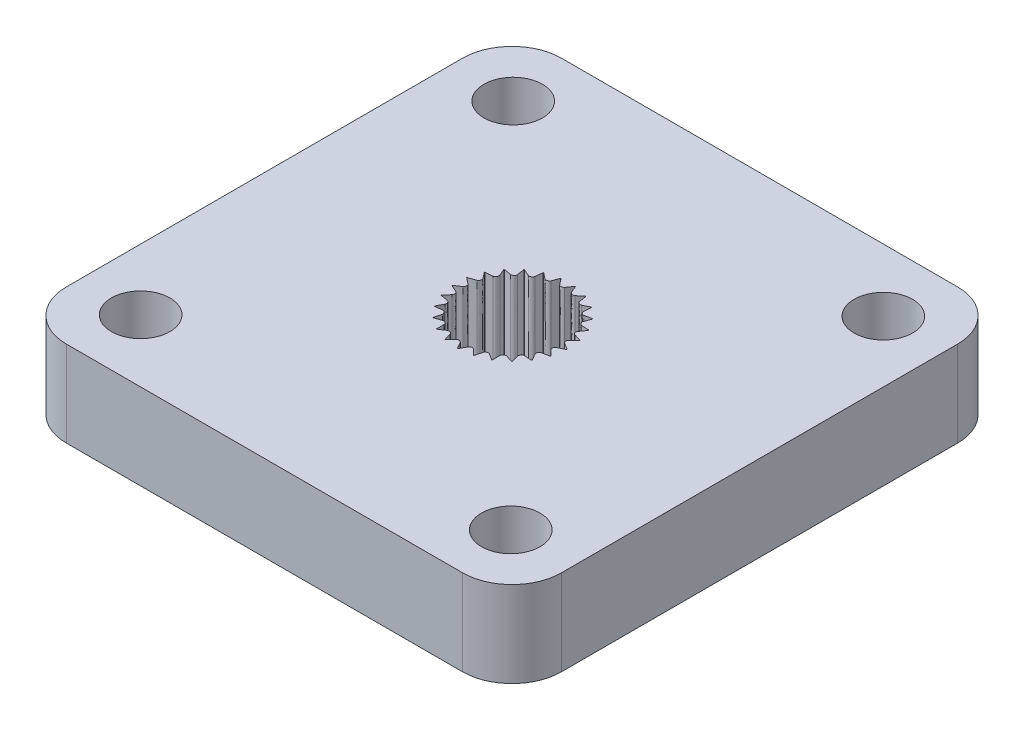
from build123d import *

# Parameters (mm, degrees)
SKETCH1_W                = 50.242939657
SKETCH1_H                = 34.945508309
BOSS_EXTRUDE1_DEPTH      = 4.40000009
SKETCH4_OUTSIDE_W        = 49.217
SKETCH4_OUTSIDE_H        = 64.515
SKETCH4_OUTSIDE_W_2      = 25.4
SKETCH4_OUTSIDE_H_2      = 25.4
CUT_EXTRUDE2_DEPTH       = 289.61744755
FILLET1_R                = 2.54
SKETCH8_R                = 1.5
CUT_EXTRUDE5_DEPTH       = 969.593684521
CUT_EXTRUDE15_DEPTH      = 159.493325704
CUT_EXTRUDE15_DEPTH_BACK = 159.493325704


with BuildPart() as part:
    # Sketch1 → Boss-Extrude1 (new body)
    with BuildSketch(Plane(origin=(0, 0, 0), x_dir=(1, 0, 0), z_dir=(0, 1, 0))):
        with Locations((25.121469829, 17.472754155)):
            Rectangle(SKETCH1_W, SKETCH1_H)
    extrude(amount=BOSS_EXTRUDE1_DEPTH)

    # Sketch4 outside → Cut-Extrude2 (cut, through all)
    with BuildSketch(Plane(origin=(166.046336463, 0, -236.028144882), x_dir=(0, 0, 1), z_dir=(0, -1, 0))):
        with Locations((218.5555, 140.9245)):
            Rectangle(SKETCH4_OUTSIDE_W, SKETCH4_OUTSIDE_H)
        with Locations((220.729799041, 140.013017967)):
            Rectangle(SKETCH4_OUTSIDE_W_2, SKETCH4_OUTSIDE_H_2, mode=Mode.SUBTRACT)
    extrude(amount=-CUT_EXTRUDE2_DEPTH, mode=Mode.SUBTRACT)

    # Fillet1
    fillet1_edges = [part.edges().sort_by_distance(p)[0] for p in [
        (13.333318496, 2.200000045, -27.998345841),
        (13.333318496, 2.200000045, -2.598345841),
        (38.733318496, 2.200000045, -2.598345841),
        (38.733318496, 2.200000045, -27.998345841),
    ]]
    fillet(fillet1_edges, radius=FILLET1_R)

    # Sketch8 → Cut-Extrude5 (cut, through all)
    with BuildSketch(Plane(origin=(166.046336463, 4.40000009, 928.470733553), x_dir=(0, 0, -1), z_dir=(0, 1, 0))):
        with Locations(Location((934.213040028, 130.519158813, 0), (0, 0, 180))):
            Circle(SKETCH8_R)
        with Locations(Location((953.262938548, 130.456978601, 0), (0, 0, 180))):
            Circle(SKETCH8_R)
        with Locations(Location((934.27522024, 149.569057333, 0), (0, 0, 180))):
            Circle(SKETCH8_R)
        with Locations(Location((953.32511876, 149.506877121, 0), (0, 0, 180))):
            Circle(SKETCH8_R)
    extrude(amount=-CUT_EXTRUDE5_DEPTH, mode=Mode.SUBTRACT)

    # Sketch18 → Cut-Extrude15 (cut, two sides: drawn at the far end of the back side and taken through both)
    with BuildSketch(Plane(origin=(170.158238205, 0, -5.487929359), x_dir=(0, 0, 1), z_dir=(0, -1, 0)).offset(-CUT_EXTRUDE15_DEPTH_BACK)):
        with BuildLine():
            Line((-7.81553732, 145.670978312), (-7.686013157, 146.043168691))
            Line((-7.686013157, 146.043168691), (-7.700712208, 146.059388051))
            Line((-7.700712208, 146.059388051), (-8.0827383, 145.966155737))
            add(Edge.make_bspline(
                [(-8.0827383, 145.966155737), (-8.162378093, 145.946733366), (-8.276453, 146.04452913), (-8.269452543, 146.126203598)],
                knots=[0, 0, 0, 0, 0.000104469, 0.000104469, 0.000104469, 0.000104469], degree=3))
            Line((-8.269452543, 146.126203598), (-8.235793495, 146.518251289))
            Line((-8.235793495, 146.518251289), (-8.254057412, 146.530300779))
            Line((-8.254057412, 146.530300779), (-8.601853002, 146.345367956))
            add(Edge.make_bspline(
                [(-8.601853002, 146.345367956), (-8.67423139, 146.306892007), (-8.808967166, 146.373351257), (-8.822358242, 146.454219723)],
                knots=[0, 0, 0, 0, 0.000104469, 0.000104469, 0.000104469, 0.000104469], degree=3))
            add(Edge.make_bspline(
                [(-8.822358242, 146.454219723), (-8.843759345, 146.583460604), (-8.865134841, 146.712705726), (-8.886492178, 146.841953846)],
                knots=[0, 0, 0, 0, 0.000510366, 0.000510366, 0.000510366, 0.000510366], degree=3))
            add(Edge.make_bspline(
                [(-8.886492178, 146.841953846), (-8.893295457, 146.84432643), (-8.900107629, 146.846673666), (-8.906928411, 146.848995454)],
                knots=[-1.240533938, -1.240533938, -1.240533938, -1.240533938, -1.233076319, -1.233076319, -1.233076319, -1.233076319], degree=3))
            Line((-8.906928411, 146.848995454), (-9.198946629, 146.583520493))
            add(Edge.make_bspline(
                [(-9.198946629, 146.583520493), (-9.25958891, 146.528395395), (-9.406509819, 146.559359937), (-9.439485831, 146.634385567)],
                knots=[0, 0, 0, 0, 0.000104469, 0.000104469, 0.000104469, 0.000104469], degree=3))
            add(Edge.make_bspline(
                [(-9.439485831, 146.634385567), (-9.492071043, 146.754025221), (-9.544627887, 146.873677345), (-9.597164599, 146.993338303)],
                knots=[0, 0, 0, 0, 0.000510093, 0.000510093, 0.000510093, 0.000510093], degree=3))
            add(Edge.make_bspline(
                [(-9.597164599, 146.993338303), (-9.604364239, 146.993945968), (-9.611566202, 146.994526717), (-9.618770185, 146.995080527)],
                knots=[-0.989173981, -0.989173981, -0.989173981, -0.989173981, -0.981695437, -0.981695437, -0.981695437, -0.981695437], degree=3))
            Line((-9.618770185, 146.995080527), (-9.836462896, 146.665662497))
            add(Edge.make_bspline(
                [(-9.836462896, 146.665662497), (-9.881628693, 146.597313161), (-10.031492525, 146.590879679), (-10.082019862, 146.655366648)],
                knots=[0, 0, 0, 0, 0.000104469, 0.000104469, 0.000104469, 0.000104469], degree=3))
            add(Edge.make_bspline(
                [(-10.082019862, 146.655366648), (-10.162408017, 146.757964346), (-10.242769339, 146.860583071), (-10.323111603, 146.963216709)],
                knots=[0, 0, 0, 0, 0.000509843, 0.000509843, 0.000509843, 0.000509843], degree=3))
            add(Edge.make_bspline(
                [(-10.323111603, 146.963216709), (-10.330266319, 146.962009585), (-10.337416553, 146.960775587), (-10.344562002, 146.959514766)],
                knots=[-0.737825921, -0.737825921, -0.737825921, -0.737825921, -0.730315584, -0.730315584, -0.730315584, -0.730315584], degree=3))
            Line((-10.344562002, 146.959514766), (-10.47431649, 146.586662535))
            add(Edge.make_bspline(
                [(-10.47431649, 146.586662535), (-10.501223068, 146.509323737), (-10.644613427, 146.465961295), (-10.709546201, 146.515851058)],
                knots=[0, 0, 0, 0, 0.000104469, 0.000104469, 0.000104469, 0.000104469], degree=3))
            add(Edge.make_bspline(
                [(-10.709546201, 146.515851058), (-10.812619727, 146.595045485), (-10.915671891, 146.674267718), (-11.018708869, 146.75350969)],
                knots=[0, 0, 0, 0, 0.000509631, 0.000509631, 0.000509631, 0.000509631], degree=3))
            add(Edge.make_bspline(
                [(-11.018708869, 146.75350969), (-11.025377108, 146.750543961), (-11.032034194, 146.747553026), (-11.03867984, 146.744537012)],
                knots=[-0.486491245, -0.486491245, -0.486491245, -0.486491245, -0.47893713, -0.47893713, -0.47893713, -0.47893713], degree=3))
            add(Edge.make_bspline(
                [(-11.03867984, 146.744537012), (-11.049941551, 146.613533997), (-11.061189591, 146.482529806), (-11.072418324, 146.35152396)],
                knots=[7.6629e-05, 7.6629e-05, 7.6629e-05, 7.6629e-05, 0.000588204, 0.000588204, 0.000588204, 0.000588204], degree=3))
            add(Edge.make_bspline(
                [(-11.072418324, 146.35152396), (-11.079407273, 146.269983754), (-11.207334845, 146.19249705), (-11.282601526, 146.22463079)],
                knots=[0, 0, 0, 0, 0.000104469, 0.000104469, 0.000104469, 0.000104469], degree=3))
            add(Edge.make_bspline(
                [(-11.282601526, 146.22463079), (-11.401831, 146.275533647), (-11.521047188, 146.326467629), (-11.64025392, 146.377423723)],
                knots=[0, 0, 0, 0, 0.000509473, 0.000509473, 0.000509473, 0.000509473], degree=3))
            add(Edge.make_bspline(
                [(-11.64025392, 146.377423723), (-11.646012228, 146.37286341), (-11.651753241, 146.368281174), (-11.657476711, 146.363677213)],
                knots=[-0.235170658, -0.235170658, -0.235170658, -0.235170658, -0.22756743, -0.22756743, -0.22756743, -0.22756743], degree=3))
            add(Edge.make_bspline(
                [(-11.657476711, 146.363677213), (-11.636070888, 146.234135118), (-11.614646839, 146.104596032), (-11.593197062, 145.975061208)],
                knots=[7.6583e-05, 7.6583e-05, 7.6583e-05, 7.6583e-05, 0.000588204, 0.000588204, 0.000588204, 0.000588204], degree=3))
            add(Edge.make_bspline(
                [(-11.593197062, 145.975061208), (-11.579835719, 145.894372297), (-11.684308462, 145.787714201), (-11.765161527, 145.800043338)],
                knots=[0, 0, 0, 0, 0.000104469, 0.000104469, 0.000104469, 0.000104469], degree=3))
            add(Edge.make_bspline(
                [(-11.765161527, 145.800043338), (-11.893015627, 145.819539577), (-12.020865131, 145.83906596), (-12.148711356, 145.858613768)],
                knots=[0, 0, 0, 0, 0.000509378, 0.000509378, 0.000509378, 0.000509378], degree=3))
            add(Edge.make_bspline(
                [(-12.148711356, 145.858613768), (-12.153185774, 145.852723795), (-12.157637677, 145.846816651), (-12.162066868, 145.840892594)],
                knots=[0.016136035, 0.016136035, 0.016136035, 0.016136035, 0.023792486, 0.023792486, 0.023792486, 0.023792486], degree=3))
            add(Edge.make_bspline(
                [(-12.162066868, 145.840892594), (-12.109386805, 145.720904807), (-12.056686522, 145.600925894), (-12.003957709, 145.480959523)],
                knots=[7.6604e-05, 7.6604e-05, 7.6604e-05, 7.6604e-05, 0.000588204, 0.000588204, 0.000588204, 0.000588204], degree=3))
            add(Edge.make_bspline(
                [(-12.003957709, 145.480959523), (-11.971069622, 145.406133936), (-12.045594388, 145.277081385), (-12.126909081, 145.268810016)],
                knots=[0, 0, 0, 0, 0.000104469, 0.000104469, 0.000104469, 0.000104469], degree=3))
            add(Edge.make_bspline(
                [(-12.126909081, 145.268810016), (-12.255324099, 145.25574758), (-12.383741671, 145.242710223), (-12.512161048, 145.229690701)],
                knots=[0, 0, 0, 0, 0.000509356, 0.000509356, 0.000509356, 0.000509356], degree=3))
            add(Edge.make_bspline(
                [(-12.512161048, 145.229690701), (-12.515050538, 145.222824864), (-12.517913581, 145.215947836), (-12.520750047, 145.209059924)],
                knots=[0.267429941, 0.267429941, 0.267429941, 0.267429941, 0.275140509, 0.275140509, 0.275140509, 0.275140509], degree=3))
            add(Edge.make_bspline(
                [(-12.520750047, 145.209059924), (-12.440165046, 145.106115943), (-12.359560893, 145.003186947), (-12.278929737, 144.900279112)],
                knots=[7.6694e-05, 7.6694e-05, 7.6694e-05, 7.6694e-05, 0.000588204, 0.000588204, 0.000588204, 0.000588204], degree=3))
            add(Edge.make_bspline(
                [(-12.278929737, 144.900279112), (-12.228551589, 144.83598255), (-12.268535226, 144.692699213), (-12.345138772, 144.664346037)],
                knots=[0, 0, 0, 0, 0.000104469, 0.000104469, 0.000104469, 0.000104469], degree=3))
            add(Edge.make_bspline(
                [(-12.345138772, 144.664346037), (-12.466019032, 144.619604776), (-12.586905653, 144.574880697), (-12.707796792, 144.530168838)],
                knots=[0, 0, 0, 0, 0.000509407, 0.000509407, 0.000509407, 0.000509407], degree=3))
            add(Edge.make_bspline(
                [(-12.707796792, 144.530168838), (-12.708895587, 144.52275086), (-12.709965602, 144.515328561), (-12.711006788, 144.507902278)],
                knots=[0.51871311, 0.51871311, 0.51871311, 0.51871311, 0.526475164, 0.526475164, 0.526475164, 0.526475164], degree=3))
            add(Edge.make_bspline(
                [(-12.711006788, 144.507902278), (-12.607647533, 144.428412243), (-12.504273016, 144.348942046), (-12.400876997, 144.269499839)],
                knots=[7.6848e-05, 7.6848e-05, 7.6848e-05, 7.6848e-05, 0.000588204, 0.000588204, 0.000588204, 0.000588204], degree=3))
            add(Edge.make_bspline(
                [(-12.400876997, 144.269499839), (-12.336142791, 144.219762641), (-12.33916868, 144.071278976), (-12.40617759, 144.024651601)],
                knots=[0, 0, 0, 0, 0.000104469, 0.000104469, 0.000104469, 0.000104469], degree=3))
            Line((-12.40617759, 144.024651601), (-12.723351764, 143.803988063))
            add(Edge.make_bspline(
                [(-12.723351764, 143.803988063), (-12.722566916, 143.796484767), (-12.721752767, 143.788984478), (-12.720909356, 143.781487539)],
                knots=[0.76998691, 0.76998691, 0.76998691, 0.76998691, 0.777795741, 0.777795741, 0.777795741, 0.777795741], degree=3))
            add(Edge.make_bspline(
                [(-12.720909356, 143.781487539), (-12.601340569, 143.73037651), (-12.48176228, 143.679287699), (-12.362170619, 143.628230214)],
                knots=[7.7057e-05, 7.7057e-05, 7.7057e-05, 7.7057e-05, 0.000588204, 0.000588204, 0.000588204, 0.000588204], degree=3))
            add(Edge.make_bspline(
                [(-12.362170619, 143.628230214), (-12.287127599, 143.596191961), (-12.253093057, 143.451837666), (-12.306234172, 143.389918959)],
                knots=[0, 0, 0, 0, 0.000104469, 0.000104469, 0.000104469, 0.000104469], degree=3))
            Line((-12.306234172, 143.389918959), (-12.557860744, 143.096737121))
            add(Edge.make_bspline(
                [(-12.557860744, 143.096737121), (-12.555223285, 143.089633097), (-12.552557948, 143.082539361), (-12.549864855, 143.075456241)],
                knots=[1.021258982, 1.021258982, 1.021258982, 1.021258982, 1.029102449, 1.029102449, 1.029102449, 1.029102449], degree=3))
            add(Edge.make_bspline(
                [(-12.549864855, 143.075456241), (-12.421666915, 143.055854525), (-12.29346568, 143.03627433), (-12.165259824, 143.016724452)],
                knots=[7.731e-05, 7.731e-05, 7.731e-05, 7.731e-05, 0.000588204, 0.000588204, 0.000588204, 0.000588204], degree=3))
            add(Edge.make_bspline(
                [(-12.165259824, 143.016724452), (-12.084624578, 143.00442853), (-12.015734351, 142.873253648), (-12.051625682, 142.800007181)],
                knots=[0, 0, 0, 0, 0.000104469, 0.000104469, 0.000104469, 0.000104469], degree=3))
            Line((-12.051625682, 142.800007181), (-12.221718872, 142.452832516))
            add(Edge.make_bspline(
                [(-12.221718872, 142.452832516), (-12.217385532, 142.446589359), (-12.213027607, 142.440363194), (-12.208645298, 142.434154311)],
                knots=[1.272530424, 1.272530424, 1.272530424, 1.272530424, 1.280396399, 1.280396399, 1.280396399, 1.280396399], degree=3))
            add(Edge.make_bspline(
                [(-12.208645298, 142.434154311), (-12.079932574, 142.447203485), (-11.951221662, 142.460270559), (-11.822513314, 142.473362833)],
                knots=[7.759e-05, 7.759e-05, 7.759e-05, 7.759e-05, 0.000588204, 0.000588204, 0.000588204, 0.000588204], degree=3))
            add(Edge.make_bspline(
                [(-11.822513314, 142.473362833), (-11.741380698, 142.481615681), (-11.64200075, 142.371835135), (-11.658371166, 142.291943831)],
                knots=[-6.592e-06, -6.592e-06, -6.592e-06, -6.592e-06, 9.7975e-05, 9.7975e-05, 9.7975e-05, 9.7975e-05], degree=3))
            add(Edge.make_bspline(
                [(-11.658371166, 142.291943831), (-11.684273188, 142.165536153), (-11.710159817, 142.03912532), (-11.736035506, 141.912712249)],
                knots=[0, 0, 0, 0, 0.000510226, 0.000510226, 0.000510226, 0.000510226], degree=3))
            add(Edge.make_bspline(
                [(-11.736035506, 141.912712249), (-11.730278047, 141.90773558), (-11.724500946, 141.902781545), (-11.71870447, 141.897850374)],
                knots=[1.523802745, 1.523802745, 1.523802745, 1.523802745, 1.531679612, 1.531679612, 1.531679612, 1.531679612], degree=3))
            add(Edge.make_bspline(
                [(-11.71870447, 141.897850374), (-11.597612043, 141.942636629), (-11.476524145, 141.987435138), (-11.355442631, 142.032250889)],
                knots=[7.788e-05, 7.788e-05, 7.788e-05, 7.788e-05, 0.000588204, 0.000588204, 0.000588204, 0.000588204], degree=3))
            add(Edge.make_bspline(
                [(-11.355442631, 142.032250889), (-11.278964244, 142.060557739), (-11.155347536, 141.979050678), (-11.151179602, 141.897608368)],
                knots=[-2.1755e-05, -2.1755e-05, -2.1755e-05, -2.1755e-05, 8.3169e-05, 8.3169e-05, 8.3169e-05, 8.3169e-05], degree=3))
            add(Edge.make_bspline(
                [(-11.151179602, 141.897608368), (-11.144572381, 141.768501863), (-11.13794208, 141.639396537), (-11.131295382, 141.510292058)],
                knots=[0, 0, 0, 0, 0.000510515, 0.000510515, 0.000510515, 0.000510515], degree=3))
            add(Edge.make_bspline(
                [(-11.131295382, 141.510292058), (-11.124486845, 141.50690586), (-11.117664931, 141.503546426), (-11.110829957, 141.500213911)],
                knots=[1.775082895, 1.775082895, 1.775082895, 1.775082895, 1.782953454, 1.782953454, 1.782953454, 1.782953454], degree=3))
            Line((-11.110829957, 141.500213911), (-10.793356359, 141.721085763))
            add(Edge.make_bspline(
                [(-10.793356359, 141.721085763), (-10.755843437, 141.747188696), (-10.64929769, 141.762778089), (-10.575539537, 141.685226558), (-10.56189765, 141.64174041)],
                knots=[-3.549e-05, -3.549e-05, -3.549e-05, -3.549e-05, 1.6963e-05, 6.9416e-05, 6.9416e-05, 6.9416e-05, 6.9416e-05], degree=3))
            add(Edge.make_bspline(
                [(-10.56189765, 141.64174041), (-10.523112751, 141.518106062), (-10.48430014, 141.394480406), (-10.445467857, 141.270860933)],
                knots=[0, 0, 0, 0, 0.0005108, 0.0005108, 0.0005108, 0.0005108], degree=3))
            add(Edge.make_bspline(
                [(-10.445467857, 141.270860933), (-10.438048187, 141.269277592), (-10.430622244, 141.267723367), (-10.42319037, 141.266198332)],
                knots=[2.026372895, 2.026372895, 2.026372895, 2.026372895, 2.034225546, 2.034225546, 2.034225546, 2.034225546], degree=3))
            Line((-10.42319037, 141.266198332), (-10.171528522, 141.559421271))
            add(Edge.make_bspline(
                [(-10.171528522, 141.559421271), (-10.141769669, 141.594095548), (-10.042891545, 141.636723166), (-9.951677361, 141.579249617), (-9.927514574, 141.540394921)],
                knots=[-4.8207e-05, -4.8207e-05, -4.8207e-05, -4.8207e-05, 4.132e-06, 5.6472e-05, 5.6472e-05, 5.6472e-05, 5.6472e-05], degree=3))
            add(Edge.make_bspline(
                [(-9.927514574, 141.540394921), (-9.858908503, 141.430073707), (-9.790274228, 141.31977003), (-9.72162011, 141.209478709)],
                knots=[0, 0, 0, 0, 0.000511068, 0.000511068, 0.000511068, 0.000511068], degree=3))
            add(Edge.make_bspline(
                [(-9.72162011, 141.209478709), (-9.714069563, 141.209788847), (-9.706520171, 141.210128515), (-9.69897228, 141.210497698)],
                knots=[2.277675065, 2.277675065, 2.277675065, 2.277675065, 2.285496977, 2.285496977, 2.285496977, 2.285496977], degree=3))
            Line((-9.69897228, 141.210497698), (-9.528993494, 141.557438853))
            add(Edge.make_bspline(
                [(-9.528993494, 141.557438853), (-9.508779206, 141.598691855), (-9.422479411, 141.664925726), (-9.320814453, 141.631437241), (-9.287847801, 141.599938696)],
                knots=[-6.059e-05, -6.059e-05, -6.059e-05, -6.059e-05, -8.376e-06, 4.3837e-05, 4.3837e-05, 4.3837e-05, 4.3837e-05], degree=3))
            add(Edge.make_bspline(
                [(-9.287847801, 141.599938696), (-9.193660185, 141.509945546), (-9.099448305, 141.419977788), (-9.005219227, 141.330028053)],
                knots=[0, 0, 0, 0, 0.00051129, 0.00051129, 0.00051129, 0.00051129], degree=3))
            add(Edge.make_bspline(
                [(-9.005219227, 141.330028053), (-8.998023333, 141.332193979), (-8.990835807, 141.334387906), (-8.983656976, 141.336609735)],
                knots=[2.528990815, 2.528990815, 2.528990815, 2.528990815, 2.536769262, 2.536769262, 2.536769262, 2.536769262], degree=3))
            add(Edge.make_bspline(
                [(-8.983656976, 141.336609735), (-8.957818062, 141.462842977), (-8.931968233, 141.589073986), (-8.906103056, 141.715301849)],
                knots=[7.8763e-05, 7.8763e-05, 7.8763e-05, 7.8763e-05, 0.000588204, 0.000588204, 0.000588204, 0.000588204], degree=3))
            add(Edge.make_bspline(
                [(-8.906103056, 141.715301849), (-8.896939384, 141.760022628), (-8.829759703, 141.843812399), (-8.722836775, 141.838976368), (-8.683051972, 141.816650147)],
                knots=[-7.3515e-05, -7.3515e-05, -7.3515e-05, -7.3515e-05, -2.1344e-05, 3.0828e-05, 3.0828e-05, 3.0828e-05, 3.0828e-05], degree=3))
            add(Edge.make_bspline(
                [(-8.683051972, 141.816650147), (-8.569142896, 141.752727265), (-8.455216741, 141.688834812), (-8.341278494, 141.62496394)],
                knots=[0, 0, 0, 0, 0.000511464, 0.000511464, 0.000511464, 0.000511464], degree=3))
            add(Edge.make_bspline(
                [(-8.341278494, 141.62496394), (-8.33488859, 141.628826513), (-8.328513564, 141.632713807), (-8.322153703, 141.636625648)],
                knots=[2.780320681, 2.780320681, 2.780320681, 2.780320681, 2.788049367, 2.788049367, 2.788049367, 2.788049367], degree=3))
            add(Edge.make_bspline(
                [(-8.322153703, 141.636625648), (-8.328786482, 141.765461205), (-8.335402921, 141.894297607), (-8.341996379, 142.023135183)],
                knots=[7.8839e-05, 7.8839e-05, 7.8839e-05, 7.8839e-05, 0.000588204, 0.000588204, 0.000588204, 0.000588204], degree=3))
            add(Edge.make_bspline(
                [(-8.341996379, 142.023135183), (-8.346172779, 142.104744434), (-8.230060741, 142.19801014), (-8.151105716, 142.176947941)],
                knots=[-8.8225e-05, -8.8225e-05, -8.8225e-05, -8.8225e-05, 1.6812e-05, 1.6812e-05, 1.6812e-05, 1.6812e-05], degree=3))
            add(Edge.make_bspline(
                [(-8.151105716, 142.176947941), (-8.024587848, 142.143197153), (-7.898061603, 142.109477755), (-7.771529444, 142.075780585)],
                knots=[0, 0, 0, 0, 0.000511577, 0.000511577, 0.000511577, 0.000511577], degree=3))
            add(Edge.make_bspline(
                [(-7.771529444, 142.075780585), (-7.766337342, 142.08107405), (-7.761165515, 142.08638748), (-7.756014192, 142.091720638)],
                knots=[3.031664252, 3.031664252, 3.031664252, 3.031664252, 3.039339324, 3.039339324, 3.039339324, 3.039339324], degree=3))
            add(Edge.make_bspline(
                [(-7.756014192, 142.091720638), (-7.794745263, 142.215018292), (-7.833456743, 142.338322104), (-7.872140662, 142.46163456)],
                knots=[7.8842e-05, 7.8842e-05, 7.8842e-05, 7.8842e-05, 0.000588204, 0.000588204, 0.000588204, 0.000588204], degree=3))
            add(Edge.make_bspline(
                [(-7.872140662, 142.46163456), (-7.896616183, 142.539655005), (-7.807193141, 142.659095309), (-7.725428232, 142.658234742)],
                knots=[-0.000104457, -0.000104457, -0.000104457, -0.000104457, 1.349e-06, 1.349e-06, 1.349e-06, 1.349e-06], degree=3))
            add(Edge.make_bspline(
                [(-7.725428232, 142.658234742), (-7.594217389, 142.656853761), (-7.46300625, 142.655500801), (-7.331794913, 142.654167692)],
                knots=[0, 0, 0, 0, 0.000511622, 0.000511622, 0.000511622, 0.000511622], degree=3))
            add(Edge.make_bspline(
                [(-7.331794913, 142.654167692), (-7.328108719, 142.660541156), (-7.324446785, 142.666928713), (-7.320809271, 142.673330084)],
                knots=[-3.000165003, -3.000165003, -3.000165003, -3.000165003, -2.992543848, -2.992543848, -2.992543848, -2.992543848], degree=3))
            add(Edge.make_bspline(
                [(-7.320809271, 142.673330084), (-7.389260616, 142.783295831), (-7.457692098, 142.893273948), (-7.526095617, 143.003269451)],
                knots=[7.8771e-05, 7.8771e-05, 7.8771e-05, 7.8771e-05, 0.000588204, 0.000588204, 0.000588204, 0.000588204], degree=3))
            add(Edge.make_bspline(
                [(-7.526095617, 143.003269451), (-7.569304943, 143.072751717), (-7.512276301, 143.210921527), (-7.432784163, 143.230307889)],
                knots=[0, 0, 0, 0, 0.000104469, 0.000104469, 0.000104469, 0.000104469], degree=3))
            add(Edge.make_bspline(
                [(-7.432784163, 143.230307889), (-7.305096093, 143.261448165), (-7.177413194, 143.292609651), (-7.049733965, 143.323786156)],
                knots=[0, 0, 0, 0, 0.000511598, 0.000511598, 0.000511598, 0.000511598], degree=3))
            add(Edge.make_bspline(
                [(-7.049733965, 143.323786156), (-7.047762199, 143.330828952), (-7.045817076, 143.337879261), (-7.04389868, 143.344936781)],
                knots=[-2.748798385, -2.748798385, -2.748798385, -2.748798385, -2.741228093, -2.741228093, -2.741228093, -2.741228093], degree=3))
            add(Edge.make_bspline(
                [(-7.04389868, 143.344936781), (-7.137834567, 143.43460687), (-7.231753342, 143.524294892), (-7.325648011, 143.61400814)],
                knots=[7.8634e-05, 7.8634e-05, 7.8634e-05, 7.8634e-05, 0.000588204, 0.000588204, 0.000588204, 0.000588204], degree=3))
            add(Edge.make_bspline(
                [(-7.325648011, 143.61400814), (-7.384842205, 143.670566233), (-7.363884497, 143.818817833), (-7.291593736, 143.857247201)],
                knots=[0, 0, 0, 0, 0.000104469, 0.000104469, 0.000104469, 0.000104469], degree=3))
            add(Edge.make_bspline(
                [(-7.291593736, 143.857247201), (-7.175421783, 143.919003566), (-7.059256538, 143.980772551), (-6.943096045, 144.04255047)],
                knots=[0, 0, 0, 0, 0.000511508, 0.000511508, 0.000511508, 0.000511508], degree=3))
            add(Edge.make_bspline(
                [(-6.943096045, 144.04255047), (-6.942939034, 144.04981918), (-6.94280937, 144.057088532), (-6.942707059, 144.064358217)],
                knots=[-2.497423669, -2.497423669, -2.497423669, -2.497423669, -2.489898205, -2.489898205, -2.489898205, -2.489898205], degree=3))
            add(Edge.make_bspline(
                [(-6.942707059, 144.064358217), (-7.056295274, 144.128033056), (-7.169871456, 144.191729369), (-7.283430668, 144.255455917)],
                knots=[7.8439e-05, 7.8439e-05, 7.8439e-05, 7.8439e-05, 0.000588204, 0.000588204, 0.000588204, 0.000588204], degree=3))
            add(Edge.make_bspline(
                [(-7.283430668, 144.255455917), (-7.354863612, 144.295542271), (-7.371381036, 144.444568914), (-7.310768926, 144.499666585)],
                knots=[0, 0, 0, 0, 0.000104469, 0.000104469, 0.000104469, 0.000104469], degree=3))
            Line((-7.310768926, 144.499666585), (-7.018600016, 144.76527823))
            add(Edge.make_bspline(
                [(-7.018600016, 144.76527823), (-7.020247818, 144.772322676), (-7.021922005, 144.779361001), (-7.023622506, 144.786392911)],
                knots=[-2.246042877, -2.246042877, -2.246042877, -2.246042877, -2.2385546, -2.2385546, -2.2385546, -2.2385546], degree=3))
            add(Edge.make_bspline(
                [(-7.023622506, 144.786392911), (-7.149794859, 144.819994409), (-7.275961321, 144.853618045), (-7.40211946, 144.887272869)],
                knots=[7.82e-05, 7.82e-05, 7.82e-05, 7.82e-05, 0.000588204, 0.000588204, 0.000588204, 0.000588204], degree=3))
            add(Edge.make_bspline(
                [(-7.40211946, 144.887272869), (-7.481294894, 144.90839426), (-7.53432014, 145.048821187), (-7.489143303, 145.117187231)],
                knots=[0, 0, 0, 0, 0.000104469, 0.000104469, 0.000104469, 0.000104469], degree=3))
            Line((-7.489143303, 145.117187231), (-7.271505651, 145.446521944))
            add(Edge.make_bspline(
                [(-7.271505651, 145.446521944), (-7.274842831, 145.452913994), (-7.278203885, 145.459293636), (-7.281588674, 145.465660605)],
                knots=[-1.994662003, -1.994662003, -1.994662003, -1.994662003, -1.987198515, -1.987198515, -1.987198515, -1.987198515], degree=3))
            add(Edge.make_bspline(
                [(-7.281588674, 145.465660605), (-7.41247964, 145.466990562), (-7.543370409, 145.468340293), (-7.674260883, 145.469717902)],
                knots=[7.7933e-05, 7.7933e-05, 7.7933e-05, 7.7933e-05, 0.000588204, 0.000588204, 0.000588204, 0.000588204], degree=3))
            add(Edge.make_bspline(
                [(-7.674260883, 145.469717902), (-7.756221637, 145.470580531), (-7.84247008, 145.593564258), (-7.81553732, 145.670978312)],
                knots=[0, 0, 0, 0, 0.000104469, 0.000104469, 0.000104469, 0.000104469], degree=3))
        make_face()
    extrude(amount=CUT_EXTRUDE15_DEPTH + CUT_EXTRUDE15_DEPTH_BACK, mode=Mode.SUBTRACT)


solid = part.part
